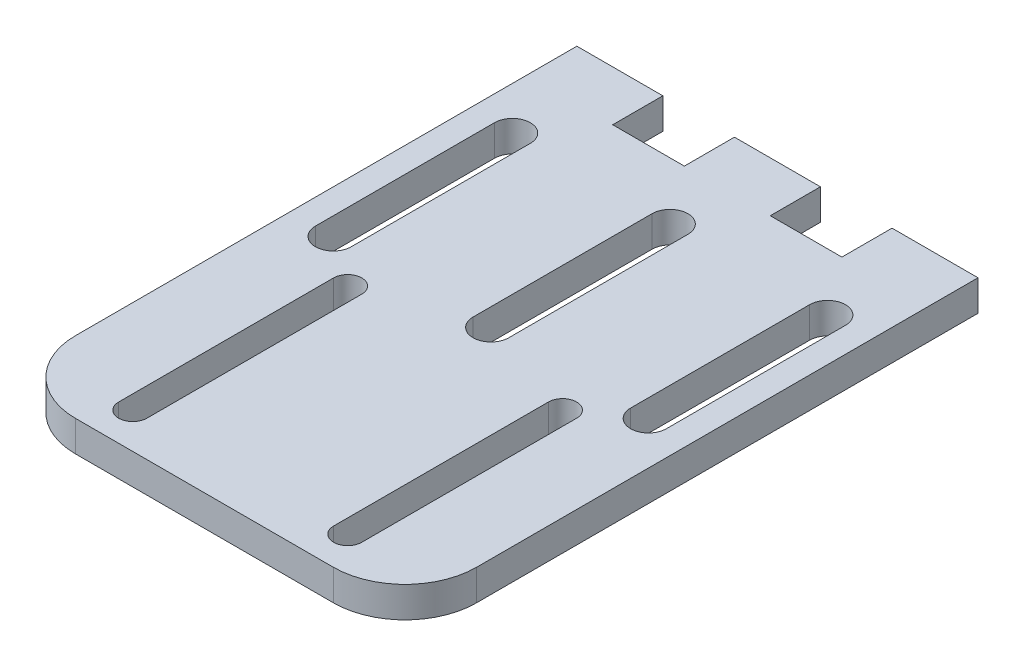
from build123d import *

# Parameters (mm, degrees)
BOSS_EXTRUDE1_DEPTH = 4.3
FILLET1_R           = 10


with BuildPart() as part:
    # Sketch1 → Boss-Extrude1 (new body)
    with BuildSketch(Plane(origin=(0, 0, 0), x_dir=(1, 0, 0), z_dir=(0, 1, 0))):
        Polygon((0, 0), (0, 80), (12, 80), (12, 73), (22, 73), (22, 80), (34, 80), (34, 73), (44, 73), (44, 80), (56, 80), (56, 0), align=None)
        with BuildLine():
            Line((14.966953147, 35), (14.966953147, 5))
            ThreePointArc((14.966953147, 5), (13, 3.033046853), (11.033046853, 5))
            Line((11.033046853, 5), (11.033046853, 35))
            ThreePointArc((11.033046853, 35), (13, 36.966953147), (14.966953147, 35))
        make_face(mode=Mode.SUBTRACT)
        with BuildLine():
            Line((8.5, 65), (8.5, 40))
            ThreePointArc((8.5, 40), (6, 37.5), (3.5, 40))
            Line((3.5, 40), (3.5, 65))
            ThreePointArc((3.5, 65), (6, 67.5), (8.5, 65))
        make_face(mode=Mode.SUBTRACT)
        with BuildLine():
            Line((41.033046853, 35), (41.033046853, 5))
            ThreePointArc((41.033046853, 5), (43, 3.033046853), (44.966953147, 5))
            Line((44.966953147, 5), (44.966953147, 35))
            ThreePointArc((44.966953147, 35), (43, 36.966953147), (41.033046853, 35))
        make_face(mode=Mode.SUBTRACT)
        with BuildLine():
            Line((25.5, 65), (25.5, 40))
            ThreePointArc((25.5, 40), (28, 37.5), (30.5, 40))
            Line((30.5, 40), (30.5, 65))
            ThreePointArc((30.5, 65), (28, 67.5), (25.5, 65))
        make_face(mode=Mode.SUBTRACT)
        with BuildLine():
            Line((47.5, 65), (47.5, 40))
            ThreePointArc((47.5, 40), (50, 37.5), (52.5, 40))
            Line((52.5, 40), (52.5, 65))
            ThreePointArc((52.5, 65), (50, 67.5), (47.5, 65))
        make_face(mode=Mode.SUBTRACT)
    extrude(amount=BOSS_EXTRUDE1_DEPTH)

    # Fillet1
    fillet1_edges = [part.edges().sort_by_distance(p)[0] for p in [
        (0, 2.15, 0),
        (56, 2.15, 0),
    ]]
    fillet(fillet1_edges, radius=FILLET1_R)


solid = part.part
